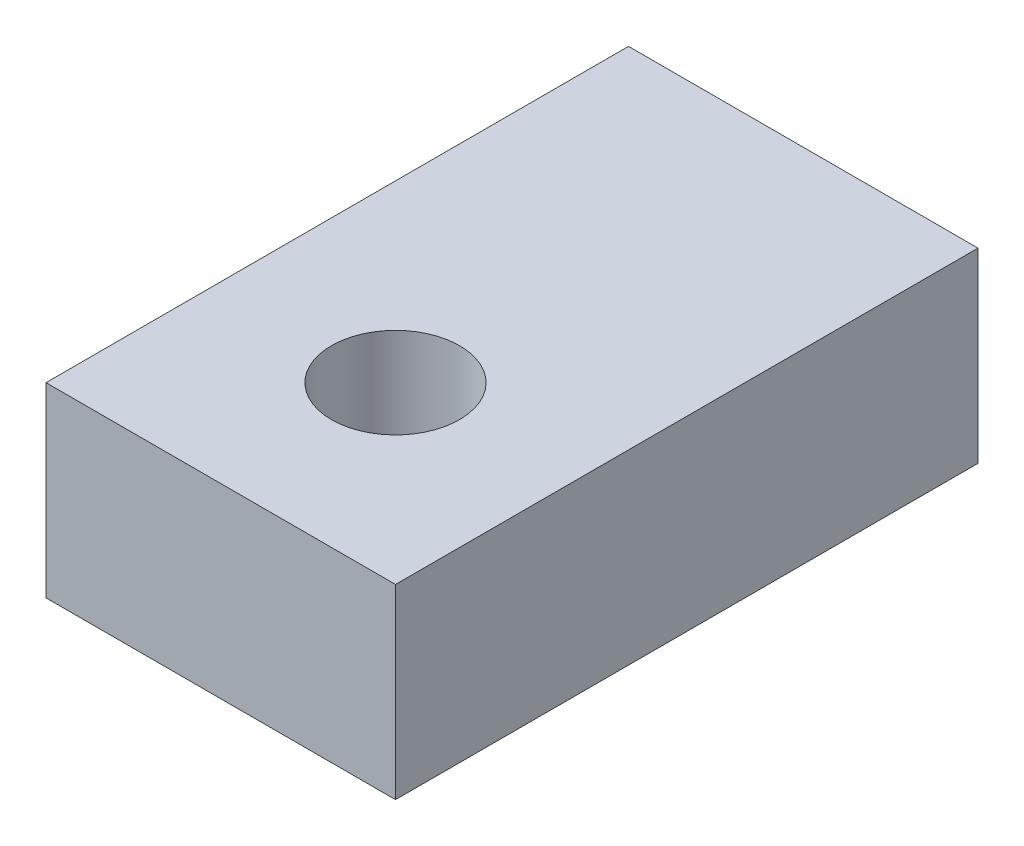
from build123d import *

# Parameters (mm, degrees)
SKETCH_1_W          = 60
SKETCH_1_H          = 100
EXTRUDE_1_DEPTH     = 32
SKETCH_4_R          = 11
CUT_EXTRUDE_3_DEPTH = 110.197069558


with BuildPart() as part:
    # 草图1 → 拉伸1 (new body)
    with BuildSketch(Plane(origin=(0, 0, 0), x_dir=(1, 0, 0), z_dir=(0, 1, 0))):
        with Locations((0, -50)):
            Rectangle(SKETCH_1_W, SKETCH_1_H)
    extrude(amount=EXTRUDE_1_DEPTH)

    # 草图4 → 拉伸3 (cut, through all)
    with BuildSketch(Plane(origin=(0, 32, 0), x_dir=(1, 0, 0), z_dir=(0, 1, 0))):
        with Locations(Location((0, -70, 0), (0, 0, 270))):
            Circle(SKETCH_4_R)
    extrude(amount=-CUT_EXTRUDE_3_DEPTH, mode=Mode.SUBTRACT)


solid = part.part
